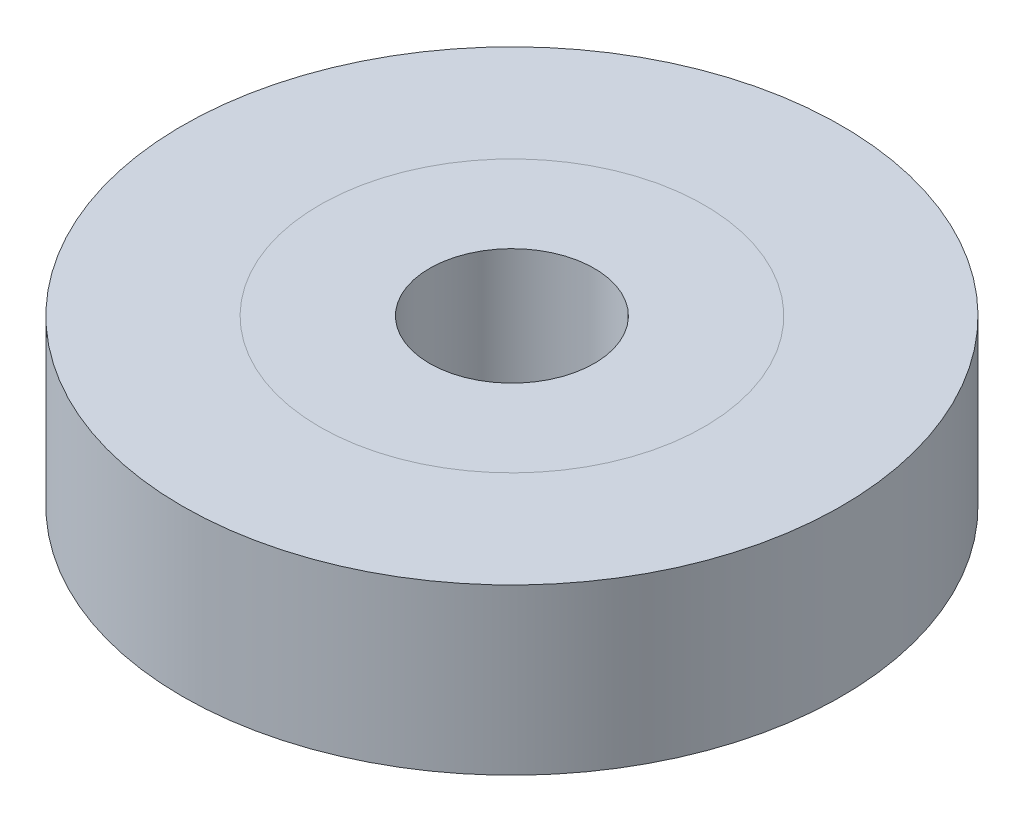
from build123d import *

# Parameters (mm, degrees)
SKETCH_1_R      = 3.5
SKETCH_1_R_2    = 1.5
EXTRUDE_1_DEPTH = 1.5
SKETCH_2_R      = 6
SKETCH_2_R_2    = 3.5
EXTRUDE_2_DEPTH = 1.5


with BuildPart() as part:
    # 草图1 → 凸台-拉伸1 (new, symmetric)
    with BuildSketch(Plane(origin=(0, 0, 0), x_dir=(1, 0, 0), z_dir=(0, 1, 0))):
        with Locations(Location((0, 0, 0), (0, 0, 270))):
            Circle(SKETCH_1_R)
        with Locations(Location((0, 0, 0), (0, 0, 270))):
            Circle(SKETCH_1_R_2, mode=Mode.SUBTRACT)
    extrude(amount=EXTRUDE_1_DEPTH, both=True)


with BuildPart() as body_2:
    # 草图2 → 凸台-拉伸2 (new, symmetric)
    with BuildSketch(Plane(origin=(0, 0, 0), x_dir=(1, 0, 0), z_dir=(0, 1, 0))):
        with Locations(Location((0, 0, 0), (0, 0, 270))):
            Circle(SKETCH_2_R)
        with Locations(Location((0, 0, 0), (0, 0, 270))):
            Circle(SKETCH_2_R_2, mode=Mode.SUBTRACT)
    extrude(amount=EXTRUDE_2_DEPTH, both=True)


solid = Compound([part.part, body_2.part])
